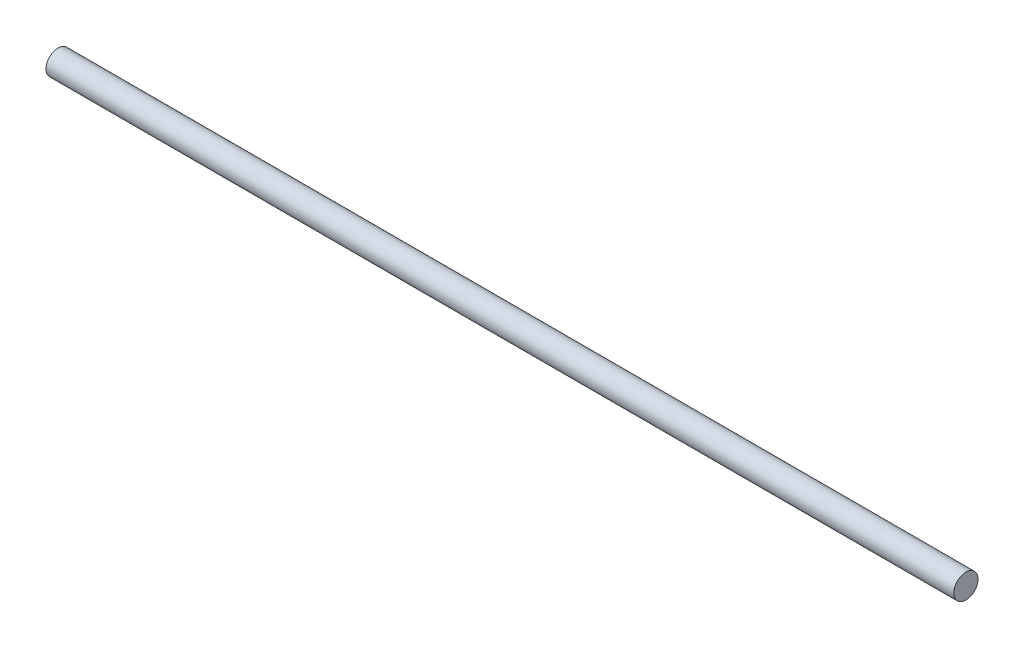
from build123d import *

# Parameters (mm, degrees)
SKETCH_1_R      = 2
EXTRUDE_1_DEPTH = 150


with BuildPart() as part:
    # 草图1 → 凸台-拉伸1 (new body)
    with BuildSketch(Plane(origin=(0, 0, 0), x_dir=(0, 0, -1), z_dir=(1, 0, 0))):
        Circle(SKETCH_1_R)
    extrude(amount=EXTRUDE_1_DEPTH)


solid = part.part
